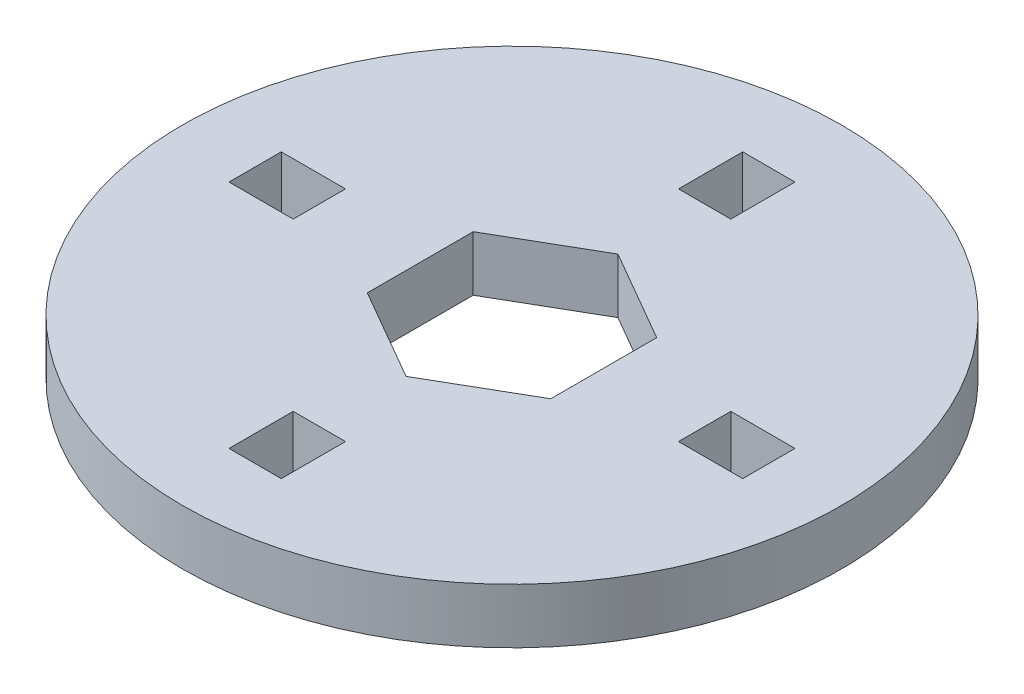
from build123d import *

# Parameters (mm, degrees)
SKETCH1_R           = 17.962739212
SKETCH1_W           = 3.5
SKETCH1_H           = 2.85
SKETCH1_W_2         = 2.85
SKETCH1_H_2         = 3.5
BOSS_EXTRUDE1_DEPTH = 3


with BuildPart() as part:
    # Sketch1 → Boss-Extrude1 (new body)
    with BuildSketch(Plane(origin=(0, 0, 0), x_dir=(1, 0, 0), z_dir=(0, 1, 0))):
        with Locations(Location((0, 0, 0), (0, 0, 270))):
            Circle(SKETCH1_R)
        with Locations((-12.25, 0)):
            Rectangle(SKETCH1_W, SKETCH1_H, mode=Mode.SUBTRACT)
        with Locations((0, -12.25)):
            Rectangle(SKETCH1_W_2, SKETCH1_H_2, mode=Mode.SUBTRACT)
        with Locations((0, 12.25)):
            Rectangle(SKETCH1_W_2, SKETCH1_H_2, mode=Mode.SUBTRACT)
        with Locations((12.25, 0)):
            Rectangle(SKETCH1_W, SKETCH1_H, mode=Mode.SUBTRACT)
        Polygon((0, -5.773502692), (5, -2.886751346), (5, 2.886751346), (0, 5.773502692), (-5, 2.886751346), (-5, -2.886751346), align=None, mode=Mode.SUBTRACT)
    extrude(amount=BOSS_EXTRUDE1_DEPTH)


solid = part.part
